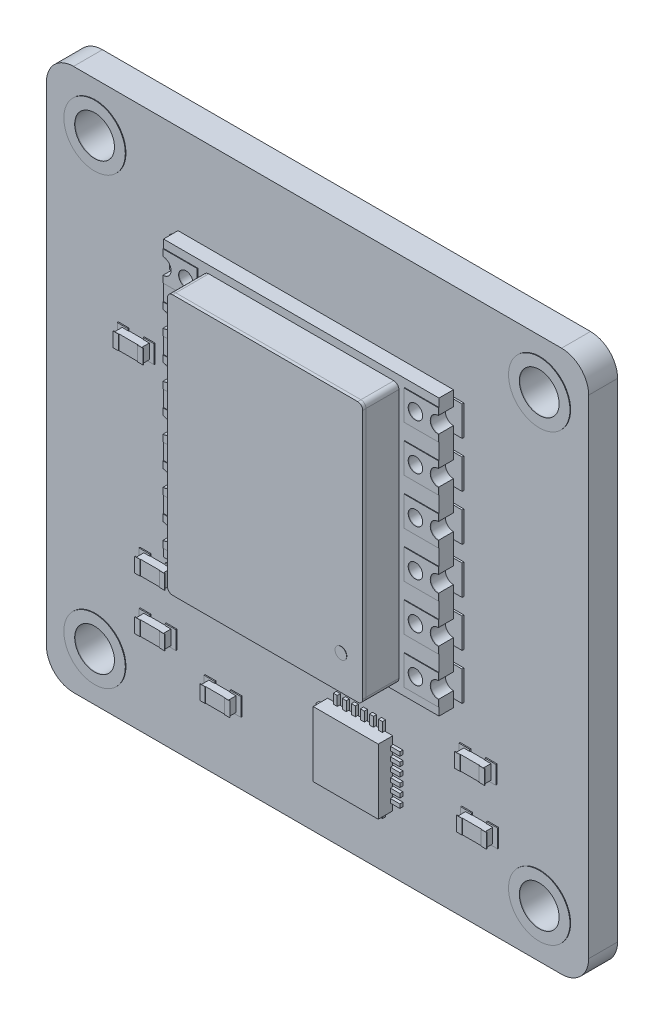
from build123d import *

# Parameters (mm, degrees)
PCB_30X30X1_6_D2_2_24_6_2_R              = 1.1
PCB_30X30X1_6_D2_2_24_6_DEPTH            = 1.6
EXTRUDE_START                            = 1.6
SKETCH_399_R                             = 1.7
SKETCH_399_R_2                           = 1.1
EXTRUDE_423_DEPTH                        = 0.035
EXTRUDE_423_2_DEPTH                      = 0.035
EXTRUDE_423_3_DEPTH                      = 0.035
EXTRUDE_423_4_DEPTH                      = 0.035
SKETCH_12_2_54_W                         = 2.5
SKETCH_12_2_54_H                         = 1.65
EXTRUDE_12_2_54_DEPTH                    = 0.1
EXTRUDE_12_2_54_2_DEPTH                  = 0.1
EXTRUDE_12_2_54_3_DEPTH                  = 0.1
EXTRUDE_12_2_54_4_DEPTH                  = 0.1
EXTRUDE_12_2_54_5_DEPTH                  = 0.1
EXTRUDE_12_2_54_6_DEPTH                  = 0.1
EXTRUDE_12_2_54_7_DEPTH                  = 0.1
EXTRUDE_12_2_54_8_DEPTH                  = 0.1
EXTRUDE_12_2_54_9_DEPTH                  = 0.1
EXTRUDE_12_2_54_10_DEPTH                 = 0.1
EXTRUDE_12_2_54_11_DEPTH                 = 0.1
EXTRUDE_12_2_54_12_DEPTH                 = 0.1
PCB_15_24X15_24X0_8_START                = 1.7
PCB_15_24X15_24X0_8_DEPTH                = 0.8
EXTRUDE_START_2                          = 2.5
EXTRUDE_12_DEPTH                         = 0.035
EXTRUDE_12_2_DEPTH                       = 0.035
EXTRUDE_12_3_DEPTH                       = 0.035
EXTRUDE_12_4_DEPTH                       = 0.035
EXTRUDE_12_5_DEPTH                       = 0.035
EXTRUDE_12_6_DEPTH                       = 0.035
EXTRUDE_12_7_DEPTH                       = 0.035
EXTRUDE_12_8_DEPTH                       = 0.035
EXTRUDE_12_9_DEPTH                       = 0.035
EXTRUDE_12_10_DEPTH                      = 0.035
EXTRUDE_12_11_DEPTH                      = 0.035
EXTRUDE_12_12_DEPTH                      = 0.035
EXTRUDE_0_18_DEPTH                       = 1.82
EXTRUDE_START_3                          = 4.32
EXTRUDE_0_18_2_8_DEPTH                   = 0.18
EXTRUDE_START_4                          = 4.5
SKETCH_1987_R                            = 0.32
EXTRUDE_1996_DEPTH                       = 0.012
EXTRUDE_START_5                          = 1.64
SKETCH_4X4_W                             = 3.6
SKETCH_4X4_H                             = 3.6
EXTRUDE_4X4_DEPTH                        = 0.8
SKETCH_24_W                              = 0.22
SKETCH_24_H                              = 0.55
EXTRUDE_24_DEPTH                         = 0.17
EXTRUDE_24_2_DEPTH                       = 0.17
SKETCH_24_W_2                            = 0.55
SKETCH_24_H_2                            = 0.22
EXTRUDE_24_3_DEPTH                       = 0.17
EXTRUDE_24_4_DEPTH                       = 0.17
EXTRUDE_24_5_DEPTH                       = 0.17
EXTRUDE_24_6_DEPTH                       = 0.17
EXTRUDE_24_7_DEPTH                       = 0.17
EXTRUDE_24_8_DEPTH                       = 0.17
EXTRUDE_24_9_DEPTH                       = 0.17
EXTRUDE_24_10_DEPTH                      = 0.17
EXTRUDE_24_11_DEPTH                      = 0.17
EXTRUDE_24_12_DEPTH                      = 0.17
EXTRUDE_24_13_DEPTH                      = 0.17
EXTRUDE_24_14_DEPTH                      = 0.17
EXTRUDE_24_15_DEPTH                      = 0.17
EXTRUDE_24_16_DEPTH                      = 0.17
EXTRUDE_24_17_DEPTH                      = 0.17
EXTRUDE_24_18_DEPTH                      = 0.17
EXTRUDE_24_19_DEPTH                      = 0.17
EXTRUDE_24_20_DEPTH                      = 0.17
EXTRUDE_24_21_DEPTH                      = 0.17
EXTRUDE_24_22_DEPTH                      = 0.17
EXTRUDE_24_23_DEPTH                      = 0.17
EXTRUDE_24_24_DEPTH                      = 0.17
SKETCH_3158_W                            = 0.6
SKETCH_3158_H                            = 1
EXTRUDE_3393_DEPTH                       = 0.06
EXTRUDE_3393_2_DEPTH                     = 0.06
EXTRUDE_3393_3_DEPTH                     = 0.06
EXTRUDE_3393_4_DEPTH                     = 0.06
EXTRUDE_3393_5_DEPTH                     = 0.06
EXTRUDE_3393_6_DEPTH                     = 0.06
EXTRUDE_3393_7_DEPTH                     = 0.06
EXTRUDE_3393_8_DEPTH                     = 0.06
EXTRUDE_3393_9_DEPTH                     = 0.06
EXTRUDE_3393_10_DEPTH                    = 0.06
EXTRUDE_3393_11_DEPTH                    = 0.06
EXTRUDE_3393_12_DEPTH                    = 0.06
SKETCH_1_W                               = 1.5
SKETCH_1_H                               = 0.8
EXTRUDE_1_DEPTH                          = 0.42
SKETCH_2_W                               = 1.5
SKETCH_2_H                               = 0.8
EXTRUDE_2_DEPTH                          = 0.42
SKETCH_3_W                               = 1.5
SKETCH_3_H                               = 0.8
EXTRUDE_3_DEPTH                          = 0.42
SKETCH_4_W                               = 1.5
SKETCH_4_H                               = 0.8
EXTRUDE_4_DEPTH                          = 0.42
SKETCH_5_W                               = 1.5
SKETCH_5_H                               = 0.8
EXTRUDE_5_DEPTH                          = 0.42
SKETCH_6_W                               = 1.5
SKETCH_6_H                               = 0.8
EXTRUDE_6_DEPTH                          = 0.42
EXTRUDE_START_6                          = 2.06
SKETCH_4124_W                            = 0.3
SKETCH_4124_H                            = 0.8
EXTRUDE_4359_DEPTH                       = 0.025
EXTRUDE_4359_2_DEPTH                     = 0.025
EXTRUDE_4359_3_DEPTH                     = 0.025
EXTRUDE_4359_4_DEPTH                     = 0.025
EXTRUDE_4359_5_DEPTH                     = 0.025
EXTRUDE_4359_6_DEPTH                     = 0.025
EXTRUDE_4359_7_DEPTH                     = 0.025
EXTRUDE_4359_8_DEPTH                     = 0.025
EXTRUDE_4359_9_DEPTH                     = 0.025
EXTRUDE_4359_10_DEPTH                    = 0.025
EXTRUDE_4359_11_DEPTH                    = 0.025
EXTRUDE_4359_12_DEPTH                    = 0.025
CUT_EXTRUDE_12_D0_8_12_7_2_54_DEPTH      = 22.687741791
CUT_EXTRUDE_12_D0_8_12_7_2_54_DEPTH_BACK = 22.687741791
F_12XD0_8_R                              = 0.4


with BuildPart() as part:
    # PCB_30x30x1.6__D2.2__24.6 2 → PCB_30x30x1.6__D2.2__24.6 (new body)
    with BuildSketch(Plane.XY):
        with BuildLine():
            Line((-13.5, -15), (13.5, -15))
            ThreePointArc((13.5, -15), (14.560660172, -14.560660172), (15, -13.5))
            Line((15, -13.5), (15, 13.5))
            ThreePointArc((15, 13.5), (14.560660172, 14.560660172), (13.5, 15))
            Line((13.5, 15), (-13.5, 15))
            ThreePointArc((-13.5, 15), (-14.560660172, 14.560660172), (-15, 13.5))
            Line((-15, 13.5), (-15, -13.5))
            ThreePointArc((-15, -13.5), (-14.560660172, -14.560660172), (-13.5, -15))
        make_face()
        with Locations((-12.3, -12.3)):
            Circle(PCB_30X30X1_6_D2_2_24_6_2_R, mode=Mode.SUBTRACT)
        with Locations((-12.3, 12.3)):
            Circle(PCB_30X30X1_6_D2_2_24_6_2_R, mode=Mode.SUBTRACT)
        with Locations((12.3, -12.3)):
            Circle(PCB_30X30X1_6_D2_2_24_6_2_R, mode=Mode.SUBTRACT)
        with Locations((12.3, 12.3)):
            Circle(PCB_30X30X1_6_D2_2_24_6_2_R, mode=Mode.SUBTRACT)
    extrude(amount=PCB_30X30X1_6_D2_2_24_6_DEPTH)


with BuildPart() as body_2:
    # Sketch 399 → Extrude 423 (new body)
    with BuildSketch(Plane.XY.offset(EXTRUDE_START)):
        with Locations((-12.3, -12.3)):
            Circle(SKETCH_399_R)
        with Locations((-12.3, -12.3)):
            Circle(SKETCH_399_R_2, mode=Mode.SUBTRACT)
    extrude(amount=EXTRUDE_423_DEPTH)


with BuildPart() as body_3:
    # Sketch 399 → Extrude 423 2 (new body)
    with BuildSketch(Plane.XY.offset(EXTRUDE_START)):
        with Locations((-12.3, 12.3)):
            Circle(SKETCH_399_R)
        with Locations((-12.3, 12.3)):
            Circle(SKETCH_399_R_2, mode=Mode.SUBTRACT)
    extrude(amount=EXTRUDE_423_2_DEPTH)


with BuildPart() as body_4:
    # Sketch 399 → Extrude 423 3 (new body)
    with BuildSketch(Plane.XY.offset(EXTRUDE_START)):
        with Locations((12.3, -12.3)):
            Circle(SKETCH_399_R)
        with Locations((12.3, -12.3)):
            Circle(SKETCH_399_R_2, mode=Mode.SUBTRACT)
    extrude(amount=EXTRUDE_423_3_DEPTH)


with BuildPart() as body_5:
    # Sketch 399 → Extrude 423 4 (new body)
    with BuildSketch(Plane.XY.offset(EXTRUDE_START)):
        with Locations((12.3, 12.3)):
            Circle(SKETCH_399_R)
        with Locations((12.3, 12.3)):
            Circle(SKETCH_399_R_2, mode=Mode.SUBTRACT)
    extrude(amount=EXTRUDE_423_4_DEPTH)


with BuildPart() as body_6:
    # 载板12处焊接焊盘_间距2.54_草图 → 载板12处焊接焊盘_间距2.54 (new body)
    with BuildSketch(Plane.XY.offset(EXTRUDE_START)):
        with Locations((-6.85, -3.85)):
            Rectangle(SKETCH_12_2_54_W, SKETCH_12_2_54_H)
    extrude(amount=EXTRUDE_12_2_54_DEPTH)


with BuildPart() as body_7:
    # 载板12处焊接焊盘_间距2.54_草图 → Extrude 12___2.54 2 (new body)
    with BuildSketch(Plane.XY.offset(EXTRUDE_START)):
        with Locations((-6.85, -1.31)):
            Rectangle(SKETCH_12_2_54_W, SKETCH_12_2_54_H)
    extrude(amount=EXTRUDE_12_2_54_2_DEPTH)


with BuildPart() as body_8:
    # 载板12处焊接焊盘_间距2.54_草图 → Extrude 12___2.54 3 (new body)
    with BuildSketch(Plane.XY.offset(EXTRUDE_START)):
        with Locations((-6.85, 1.23)):
            Rectangle(SKETCH_12_2_54_W, SKETCH_12_2_54_H)
    extrude(amount=EXTRUDE_12_2_54_3_DEPTH)


with BuildPart() as body_9:
    # 载板12处焊接焊盘_间距2.54_草图 → Extrude 12___2.54 4 (new body)
    with BuildSketch(Plane.XY.offset(EXTRUDE_START)):
        with Locations((-6.85, 3.77)):
            Rectangle(SKETCH_12_2_54_W, SKETCH_12_2_54_H)
    extrude(amount=EXTRUDE_12_2_54_4_DEPTH)


with BuildPart() as body_10:
    # 载板12处焊接焊盘_间距2.54_草图 → Extrude 12___2.54 5 (new body)
    with BuildSketch(Plane.XY.offset(EXTRUDE_START)):
        with Locations((-6.85, 6.31)):
            Rectangle(SKETCH_12_2_54_W, SKETCH_12_2_54_H)
    extrude(amount=EXTRUDE_12_2_54_5_DEPTH)


with BuildPart() as body_11:
    # 载板12处焊接焊盘_间距2.54_草图 → Extrude 12___2.54 6 (new body)
    with BuildSketch(Plane.XY.offset(EXTRUDE_START)):
        with Locations((-6.85, 8.85)):
            Rectangle(SKETCH_12_2_54_W, SKETCH_12_2_54_H)
    extrude(amount=EXTRUDE_12_2_54_6_DEPTH)


with BuildPart() as body_12:
    # 载板12处焊接焊盘_间距2.54_草图 → Extrude 12___2.54 7 (new body)
    with BuildSketch(Plane.XY.offset(EXTRUDE_START)):
        with Locations((6.85, -3.85)):
            Rectangle(SKETCH_12_2_54_W, SKETCH_12_2_54_H)
    extrude(amount=EXTRUDE_12_2_54_7_DEPTH)


with BuildPart() as body_13:
    # 载板12处焊接焊盘_间距2.54_草图 → Extrude 12___2.54 8 (new body)
    with BuildSketch(Plane.XY.offset(EXTRUDE_START)):
        with Locations((6.85, -1.31)):
            Rectangle(SKETCH_12_2_54_W, SKETCH_12_2_54_H)
    extrude(amount=EXTRUDE_12_2_54_8_DEPTH)


with BuildPart() as body_14:
    # 载板12处焊接焊盘_间距2.54_草图 → Extrude 12___2.54 9 (new body)
    with BuildSketch(Plane.XY.offset(EXTRUDE_START)):
        with Locations((6.85, 1.23)):
            Rectangle(SKETCH_12_2_54_W, SKETCH_12_2_54_H)
    extrude(amount=EXTRUDE_12_2_54_9_DEPTH)


with BuildPart() as body_15:
    # 载板12处焊接焊盘_间距2.54_草图 → Extrude 12___2.54 10 (new body)
    with BuildSketch(Plane.XY.offset(EXTRUDE_START)):
        with Locations((6.85, 3.77)):
            Rectangle(SKETCH_12_2_54_W, SKETCH_12_2_54_H)
    extrude(amount=EXTRUDE_12_2_54_10_DEPTH)


with BuildPart() as body_16:
    # 载板12处焊接焊盘_间距2.54_草图 → Extrude 12___2.54 11 (new body)
    with BuildSketch(Plane.XY.offset(EXTRUDE_START)):
        with Locations((6.85, 6.31)):
            Rectangle(SKETCH_12_2_54_W, SKETCH_12_2_54_H)
    extrude(amount=EXTRUDE_12_2_54_11_DEPTH)


with BuildPart() as body_17:
    # 载板12处焊接焊盘_间距2.54_草图 → Extrude 12___2.54 12 (new body)
    with BuildSketch(Plane.XY.offset(EXTRUDE_START)):
        with Locations((6.85, 8.85)):
            Rectangle(SKETCH_12_2_54_W, SKETCH_12_2_54_H)
    extrude(amount=EXTRUDE_12_2_54_12_DEPTH)


with BuildPart() as body_18:
    # PCB_15.24x15.24x0.8 2 → PCB_15.24x15.24x0.8 (new body)
    with BuildSketch(Plane.XY.offset(PCB_15_24X15_24X0_8_START)):
        with BuildLine():
            Line((-7.62, -5.12), (7.62, -5.12))
            Line((7.62, -5.12), (7.62, -4.3))
            ThreePointArc((7.62, -4.3), (7.17, -3.85), (7.62, -3.4))
            Line((7.62, -3.4), (7.62, -1.76))
            ThreePointArc((7.62, -1.76), (7.17, -1.31), (7.62, -0.86))
            Line((7.62, -0.86), (7.62, 0.78))
            ThreePointArc((7.62, 0.78), (7.17, 1.23), (7.62, 1.68))
            Line((7.62, 1.68), (7.62, 3.32))
            ThreePointArc((7.62, 3.32), (7.17, 3.77), (7.62, 4.22))
            Line((7.62, 4.22), (7.62, 5.86))
            ThreePointArc((7.62, 5.86), (7.17, 6.31), (7.62, 6.76))
            Line((7.62, 6.76), (7.62, 8.4))
            ThreePointArc((7.62, 8.4), (7.17, 8.85), (7.62, 9.3))
            Line((7.62, 9.3), (7.62, 10.12))
            Line((7.62, 10.12), (-7.62, 10.12))
            Line((-7.62, 10.12), (-7.62, 9.3))
            ThreePointArc((-7.62, 9.3), (-7.17, 8.85), (-7.62, 8.4))
            Line((-7.62, 8.4), (-7.62, 6.76))
            ThreePointArc((-7.62, 6.76), (-7.17, 6.31), (-7.62, 5.86))
            Line((-7.62, 5.86), (-7.62, 4.22))
            ThreePointArc((-7.62, 4.22), (-7.17, 3.77), (-7.62, 3.32))
            Line((-7.62, 3.32), (-7.62, 1.68))
            ThreePointArc((-7.62, 1.68), (-7.17, 1.23), (-7.62, 0.78))
            Line((-7.62, 0.78), (-7.62, -0.86))
            ThreePointArc((-7.62, -0.86), (-7.17, -1.31), (-7.62, -1.76))
            Line((-7.62, -1.76), (-7.62, -3.4))
            ThreePointArc((-7.62, -3.4), (-7.17, -3.85), (-7.62, -4.3))
            Line((-7.62, -4.3), (-7.62, -5.12))
        make_face()
    extrude(amount=PCB_15_24X15_24X0_8_DEPTH)


with BuildPart() as body_19:
    # 模块12处半孔镀锡焊盘_草图 → 模块12处半孔镀锡焊盘 (new body)
    with BuildSketch(Plane.XY.offset(EXTRUDE_START_2)):
        with BuildLine():
            Line((-5.72, -4.67), (-5.72, -3.03))
            Line((-5.72, -3.03), (-7.62, -3.03))
            Line((-7.62, -3.03), (-7.62, -3.4))
            ThreePointArc((-7.62, -3.4), (-7.17, -3.85), (-7.62, -4.3))
            Line((-7.62, -4.3), (-7.62, -4.67))
            Line((-7.62, -4.67), (-5.72, -4.67))
        make_face()
    extrude(amount=EXTRUDE_12_DEPTH)


with BuildPart() as body_20:
    # 模块12处半孔镀锡焊盘_草图 → Extrude 12 2 (new body)
    with BuildSketch(Plane.XY.offset(EXTRUDE_START_2)):
        with BuildLine():
            Line((-5.72, -2.13), (-5.72, -0.49))
            Line((-5.72, -0.49), (-7.62, -0.49))
            Line((-7.62, -0.49), (-7.62, -0.86))
            ThreePointArc((-7.62, -0.86), (-7.17, -1.31), (-7.62, -1.76))
            Line((-7.62, -1.76), (-7.62, -2.13))
            Line((-7.62, -2.13), (-5.72, -2.13))
        make_face()
    extrude(amount=EXTRUDE_12_2_DEPTH)


with BuildPart() as body_21:
    # 模块12处半孔镀锡焊盘_草图 → Extrude 12 3 (new body)
    with BuildSketch(Plane.XY.offset(EXTRUDE_START_2)):
        with BuildLine():
            Line((-5.72, 0.41), (-5.72, 2.05))
            Line((-5.72, 2.05), (-7.62, 2.05))
            Line((-7.62, 2.05), (-7.62, 1.68))
            ThreePointArc((-7.62, 1.68), (-7.17, 1.23), (-7.62, 0.78))
            Line((-7.62, 0.78), (-7.62, 0.41))
            Line((-7.62, 0.41), (-5.72, 0.41))
        make_face()
    extrude(amount=EXTRUDE_12_3_DEPTH)


with BuildPart() as body_22:
    # 模块12处半孔镀锡焊盘_草图 → Extrude 12 4 (new body)
    with BuildSketch(Plane.XY.offset(EXTRUDE_START_2)):
        with BuildLine():
            Line((-5.72, 2.95), (-5.72, 4.59))
            Line((-5.72, 4.59), (-7.62, 4.59))
            Line((-7.62, 4.59), (-7.62, 4.22))
            ThreePointArc((-7.62, 4.22), (-7.17, 3.77), (-7.62, 3.32))
            Line((-7.62, 3.32), (-7.62, 2.95))
            Line((-7.62, 2.95), (-5.72, 2.95))
        make_face()
    extrude(amount=EXTRUDE_12_4_DEPTH)


with BuildPart() as body_23:
    # 模块12处半孔镀锡焊盘_草图 → Extrude 12 5 (new body)
    with BuildSketch(Plane.XY.offset(EXTRUDE_START_2)):
        with BuildLine():
            Line((-5.72, 5.49), (-5.72, 7.13))
            Line((-5.72, 7.13), (-7.62, 7.13))
            Line((-7.62, 7.13), (-7.62, 6.76))
            ThreePointArc((-7.62, 6.76), (-7.17, 6.31), (-7.62, 5.86))
            Line((-7.62, 5.86), (-7.62, 5.49))
            Line((-7.62, 5.49), (-5.72, 5.49))
        make_face()
    extrude(amount=EXTRUDE_12_5_DEPTH)


with BuildPart() as body_24:
    # 模块12处半孔镀锡焊盘_草图 → Extrude 12 6 (new body)
    with BuildSketch(Plane.XY.offset(EXTRUDE_START_2)):
        with BuildLine():
            Line((-5.72, 8.03), (-5.72, 9.67))
            Line((-5.72, 9.67), (-7.62, 9.67))
            Line((-7.62, 9.67), (-7.62, 9.3))
            ThreePointArc((-7.62, 9.3), (-7.17, 8.85), (-7.62, 8.4))
            Line((-7.62, 8.4), (-7.62, 8.03))
            Line((-7.62, 8.03), (-5.72, 8.03))
        make_face()
    extrude(amount=EXTRUDE_12_6_DEPTH)


with BuildPart() as body_25:
    # 模块12处半孔镀锡焊盘_草图 → Extrude 12 7 (new body)
    with BuildSketch(Plane.XY.offset(EXTRUDE_START_2)):
        with BuildLine():
            Line((5.72, -4.67), (7.62, -4.67))
            Line((7.62, -4.67), (7.62, -4.3))
            ThreePointArc((7.62, -4.3), (7.17, -3.85), (7.62, -3.4))
            Line((7.62, -3.4), (7.62, -3.03))
            Line((7.62, -3.03), (5.72, -3.03))
            Line((5.72, -3.03), (5.72, -4.67))
        make_face()
    extrude(amount=EXTRUDE_12_7_DEPTH)


with BuildPart() as body_26:
    # 模块12处半孔镀锡焊盘_草图 → Extrude 12 8 (new body)
    with BuildSketch(Plane.XY.offset(EXTRUDE_START_2)):
        with BuildLine():
            Line((5.72, -2.13), (7.62, -2.13))
            Line((7.62, -2.13), (7.62, -1.76))
            ThreePointArc((7.62, -1.76), (7.17, -1.31), (7.62, -0.86))
            Line((7.62, -0.86), (7.62, -0.49))
            Line((7.62, -0.49), (5.72, -0.49))
            Line((5.72, -0.49), (5.72, -2.13))
        make_face()
    extrude(amount=EXTRUDE_12_8_DEPTH)


with BuildPart() as body_27:
    # 模块12处半孔镀锡焊盘_草图 → Extrude 12 9 (new body)
    with BuildSketch(Plane.XY.offset(EXTRUDE_START_2)):
        with BuildLine():
            Line((5.72, 0.41), (7.62, 0.41))
            Line((7.62, 0.41), (7.62, 0.78))
            ThreePointArc((7.62, 0.78), (7.17, 1.23), (7.62, 1.68))
            Line((7.62, 1.68), (7.62, 2.05))
            Line((7.62, 2.05), (5.72, 2.05))
            Line((5.72, 2.05), (5.72, 0.41))
        make_face()
    extrude(amount=EXTRUDE_12_9_DEPTH)


with BuildPart() as body_28:
    # 模块12处半孔镀锡焊盘_草图 → Extrude 12 10 (new body)
    with BuildSketch(Plane.XY.offset(EXTRUDE_START_2)):
        with BuildLine():
            Line((5.72, 2.95), (7.62, 2.95))
            Line((7.62, 2.95), (7.62, 3.32))
            ThreePointArc((7.62, 3.32), (7.17, 3.77), (7.62, 4.22))
            Line((7.62, 4.22), (7.62, 4.59))
            Line((7.62, 4.59), (5.72, 4.59))
            Line((5.72, 4.59), (5.72, 2.95))
        make_face()
    extrude(amount=EXTRUDE_12_10_DEPTH)


with BuildPart() as body_29:
    # 模块12处半孔镀锡焊盘_草图 → Extrude 12 11 (new body)
    with BuildSketch(Plane.XY.offset(EXTRUDE_START_2)):
        with BuildLine():
            Line((5.72, 5.49), (7.62, 5.49))
            Line((7.62, 5.49), (7.62, 5.86))
            ThreePointArc((7.62, 5.86), (7.17, 6.31), (7.62, 6.76))
            Line((7.62, 6.76), (7.62, 7.13))
            Line((7.62, 7.13), (5.72, 7.13))
            Line((5.72, 7.13), (5.72, 5.49))
        make_face()
    extrude(amount=EXTRUDE_12_11_DEPTH)


with BuildPart() as body_30:
    # 模块12处半孔镀锡焊盘_草图 → Extrude 12 12 (new body)
    with BuildSketch(Plane.XY.offset(EXTRUDE_START_2)):
        with BuildLine():
            Line((5.72, 8.03), (7.62, 8.03))
            Line((7.62, 8.03), (7.62, 8.4))
            ThreePointArc((7.62, 8.4), (7.17, 8.85), (7.62, 9.3))
            Line((7.62, 9.3), (7.62, 9.67))
            Line((7.62, 9.67), (5.72, 9.67))
            Line((5.72, 9.67), (5.72, 8.03))
        make_face()
    extrude(amount=EXTRUDE_12_12_DEPTH)


with BuildPart() as body_31:
    # 屏蔽罩侧壁_厚0.18_草图 → 屏蔽罩侧壁_厚0.18 (new body)
    with BuildSketch(Plane.XY.offset(EXTRUDE_START_2)):
        with BuildLine():
            Line((-5.12, -4.7), (5.12, -4.7))
            ThreePointArc((5.12, -4.7), (5.317989899, -4.617989899), (5.4, -4.42))
            Line((5.4, -4.42), (5.4, 9.42))
            ThreePointArc((5.4, 9.42), (5.317989899, 9.617989899), (5.12, 9.7))
            Line((5.12, 9.7), (-5.12, 9.7))
            ThreePointArc((-5.12, 9.7), (-5.317989899, 9.617989899), (-5.4, 9.42))
            Line((-5.4, 9.42), (-5.4, -4.42))
            ThreePointArc((-5.4, -4.42), (-5.317989899, -4.617989899), (-5.12, -4.7))
        make_face()
        with BuildLine():
            Line((-5.12, -4.52), (5.12, -4.52))
            ThreePointArc((5.12, -4.52), (5.190710678, -4.490710678), (5.22, -4.42))
            Line((5.22, -4.42), (5.22, 9.42))
            ThreePointArc((5.22, 9.42), (5.190710678, 9.490710678), (5.12, 9.52))
            Line((5.12, 9.52), (-5.12, 9.52))
            ThreePointArc((-5.12, 9.52), (-5.190710678, 9.490710678), (-5.22, 9.42))
            Line((-5.22, 9.42), (-5.22, -4.42))
            ThreePointArc((-5.22, -4.42), (-5.190710678, -4.490710678), (-5.12, -4.52))
        make_face(mode=Mode.SUBTRACT)
    extrude(amount=EXTRUDE_0_18_DEPTH)


with BuildPart() as body_32:
    # 屏蔽罩顶盖_厚0.18_模块总高2.8_草图 → 屏蔽罩顶盖_厚0.18_模块总高2.8 (new body)
    with BuildSketch(Plane.XY.offset(EXTRUDE_START_3)):
        with BuildLine():
            Line((-5.12, -4.7), (5.12, -4.7))
            ThreePointArc((5.12, -4.7), (5.317989899, -4.617989899), (5.4, -4.42))
            Line((5.4, -4.42), (5.4, 9.42))
            ThreePointArc((5.4, 9.42), (5.317989899, 9.617989899), (5.12, 9.7))
            Line((5.12, 9.7), (-5.12, 9.7))
            ThreePointArc((-5.12, 9.7), (-5.317989899, 9.617989899), (-5.4, 9.42))
            Line((-5.4, 9.42), (-5.4, -4.42))
            ThreePointArc((-5.4, -4.42), (-5.317989899, -4.617989899), (-5.12, -4.7))
        make_face()
    extrude(amount=EXTRUDE_0_18_2_8_DEPTH)


with BuildPart() as body_33:
    # Sketch 1987 → Extrude 1996 (new body)
    with BuildSketch(Plane.XY.offset(EXTRUDE_START_4)):
        with Locations((4.2, -2.8)):
            Circle(SKETCH_1987_R)
    extrude(amount=EXTRUDE_1996_DEPTH)


with BuildPart() as body_34:
    # 载板控制芯片_4x4_草图 → 载板控制芯片_4x4 (new body)
    with BuildSketch(Plane.XY.offset(EXTRUDE_START_5)):
        with Locations((2.4, -10)):
            Rectangle(SKETCH_4X4_W, SKETCH_4X4_H)
    extrude(amount=EXTRUDE_4X4_DEPTH)


with BuildPart() as body_35:
    # 载板控制芯片24引脚_草图 → 载板控制芯片24引脚 (new body)
    with BuildSketch(Plane.XY.offset(EXTRUDE_START)):
        with Locations((1.15, -12.05)):
            Rectangle(SKETCH_24_W, SKETCH_24_H)
    extrude(amount=EXTRUDE_24_DEPTH)


with BuildPart() as body_36:
    # 载板控制芯片24引脚_草图 → Extrude 24 2 (new body)
    with BuildSketch(Plane.XY.offset(EXTRUDE_START)):
        with Locations((1.15, -7.95)):
            Rectangle(SKETCH_24_W, SKETCH_24_H)
    extrude(amount=EXTRUDE_24_2_DEPTH)


with BuildPart() as body_37:
    # 载板控制芯片24引脚_草图 → Extrude 24 3 (new body)
    with BuildSketch(Plane.XY.offset(EXTRUDE_START)):
        with Locations((0.35, -11.25)):
            Rectangle(SKETCH_24_W_2, SKETCH_24_H_2)
    extrude(amount=EXTRUDE_24_3_DEPTH)


with BuildPart() as body_38:
    # 载板控制芯片24引脚_草图 → Extrude 24 4 (new body)
    with BuildSketch(Plane.XY.offset(EXTRUDE_START)):
        with Locations((4.45, -11.25)):
            Rectangle(SKETCH_24_W_2, SKETCH_24_H_2)
    extrude(amount=EXTRUDE_24_4_DEPTH)


with BuildPart() as body_39:
    # 载板控制芯片24引脚_草图 → Extrude 24 5 (new body)
    with BuildSketch(Plane.XY.offset(EXTRUDE_START)):
        with Locations((1.65, -12.05)):
            Rectangle(SKETCH_24_W, SKETCH_24_H)
    extrude(amount=EXTRUDE_24_5_DEPTH)


with BuildPart() as body_40:
    # 载板控制芯片24引脚_草图 → Extrude 24 6 (new body)
    with BuildSketch(Plane.XY.offset(EXTRUDE_START)):
        with Locations((1.65, -7.95)):
            Rectangle(SKETCH_24_W, SKETCH_24_H)
    extrude(amount=EXTRUDE_24_6_DEPTH)


with BuildPart() as body_41:
    # 载板控制芯片24引脚_草图 → Extrude 24 7 (new body)
    with BuildSketch(Plane.XY.offset(EXTRUDE_START)):
        with Locations((0.35, -10.75)):
            Rectangle(SKETCH_24_W_2, SKETCH_24_H_2)
    extrude(amount=EXTRUDE_24_7_DEPTH)


with BuildPart() as body_42:
    # 载板控制芯片24引脚_草图 → Extrude 24 8 (new body)
    with BuildSketch(Plane.XY.offset(EXTRUDE_START)):
        with Locations((4.45, -10.75)):
            Rectangle(SKETCH_24_W_2, SKETCH_24_H_2)
    extrude(amount=EXTRUDE_24_8_DEPTH)


with BuildPart() as body_43:
    # 载板控制芯片24引脚_草图 → Extrude 24 9 (new body)
    with BuildSketch(Plane.XY.offset(EXTRUDE_START)):
        with Locations((2.15, -12.05)):
            Rectangle(SKETCH_24_W, SKETCH_24_H)
    extrude(amount=EXTRUDE_24_9_DEPTH)


with BuildPart() as body_44:
    # 载板控制芯片24引脚_草图 → Extrude 24 10 (new body)
    with BuildSketch(Plane.XY.offset(EXTRUDE_START)):
        with Locations((2.15, -7.95)):
            Rectangle(SKETCH_24_W, SKETCH_24_H)
    extrude(amount=EXTRUDE_24_10_DEPTH)


with BuildPart() as body_45:
    # 载板控制芯片24引脚_草图 → Extrude 24 11 (new body)
    with BuildSketch(Plane.XY.offset(EXTRUDE_START)):
        with Locations((0.35, -10.25)):
            Rectangle(SKETCH_24_W_2, SKETCH_24_H_2)
    extrude(amount=EXTRUDE_24_11_DEPTH)


with BuildPart() as body_46:
    # 载板控制芯片24引脚_草图 → Extrude 24 12 (new body)
    with BuildSketch(Plane.XY.offset(EXTRUDE_START)):
        with Locations((4.45, -10.25)):
            Rectangle(SKETCH_24_W_2, SKETCH_24_H_2)
    extrude(amount=EXTRUDE_24_12_DEPTH)


with BuildPart() as body_47:
    # 载板控制芯片24引脚_草图 → Extrude 24 13 (new body)
    with BuildSketch(Plane.XY.offset(EXTRUDE_START)):
        with Locations((2.65, -12.05)):
            Rectangle(SKETCH_24_W, SKETCH_24_H)
    extrude(amount=EXTRUDE_24_13_DEPTH)


with BuildPart() as body_48:
    # 载板控制芯片24引脚_草图 → Extrude 24 14 (new body)
    with BuildSketch(Plane.XY.offset(EXTRUDE_START)):
        with Locations((2.65, -7.95)):
            Rectangle(SKETCH_24_W, SKETCH_24_H)
    extrude(amount=EXTRUDE_24_14_DEPTH)


with BuildPart() as body_49:
    # 载板控制芯片24引脚_草图 → Extrude 24 15 (new body)
    with BuildSketch(Plane.XY.offset(EXTRUDE_START)):
        with Locations((0.35, -9.75)):
            Rectangle(SKETCH_24_W_2, SKETCH_24_H_2)
    extrude(amount=EXTRUDE_24_15_DEPTH)


with BuildPart() as body_50:
    # 载板控制芯片24引脚_草图 → Extrude 24 16 (new body)
    with BuildSketch(Plane.XY.offset(EXTRUDE_START)):
        with Locations((4.45, -9.75)):
            Rectangle(SKETCH_24_W_2, SKETCH_24_H_2)
    extrude(amount=EXTRUDE_24_16_DEPTH)


with BuildPart() as body_51:
    # 载板控制芯片24引脚_草图 → Extrude 24 17 (new body)
    with BuildSketch(Plane.XY.offset(EXTRUDE_START)):
        with Locations((3.15, -12.05)):
            Rectangle(SKETCH_24_W, SKETCH_24_H)
    extrude(amount=EXTRUDE_24_17_DEPTH)


with BuildPart() as body_52:
    # 载板控制芯片24引脚_草图 → Extrude 24 18 (new body)
    with BuildSketch(Plane.XY.offset(EXTRUDE_START)):
        with Locations((3.15, -7.95)):
            Rectangle(SKETCH_24_W, SKETCH_24_H)
    extrude(amount=EXTRUDE_24_18_DEPTH)


with BuildPart() as body_53:
    # 载板控制芯片24引脚_草图 → Extrude 24 19 (new body)
    with BuildSketch(Plane.XY.offset(EXTRUDE_START)):
        with Locations((0.35, -9.25)):
            Rectangle(SKETCH_24_W_2, SKETCH_24_H_2)
    extrude(amount=EXTRUDE_24_19_DEPTH)


with BuildPart() as body_54:
    # 载板控制芯片24引脚_草图 → Extrude 24 20 (new body)
    with BuildSketch(Plane.XY.offset(EXTRUDE_START)):
        with Locations((4.45, -9.25)):
            Rectangle(SKETCH_24_W_2, SKETCH_24_H_2)
    extrude(amount=EXTRUDE_24_20_DEPTH)


with BuildPart() as body_55:
    # 载板控制芯片24引脚_草图 → Extrude 24 21 (new body)
    with BuildSketch(Plane.XY.offset(EXTRUDE_START)):
        with Locations((3.65, -12.05)):
            Rectangle(SKETCH_24_W, SKETCH_24_H)
    extrude(amount=EXTRUDE_24_21_DEPTH)


with BuildPart() as body_56:
    # 载板控制芯片24引脚_草图 → Extrude 24 22 (new body)
    with BuildSketch(Plane.XY.offset(EXTRUDE_START)):
        with Locations((3.65, -7.95)):
            Rectangle(SKETCH_24_W, SKETCH_24_H)
    extrude(amount=EXTRUDE_24_22_DEPTH)


with BuildPart() as body_57:
    # 载板控制芯片24引脚_草图 → Extrude 24 23 (new body)
    with BuildSketch(Plane.XY.offset(EXTRUDE_START)):
        with Locations((0.35, -8.75)):
            Rectangle(SKETCH_24_W_2, SKETCH_24_H_2)
    extrude(amount=EXTRUDE_24_23_DEPTH)


with BuildPart() as body_58:
    # 载板控制芯片24引脚_草图 → Extrude 24 24 (new body)
    with BuildSketch(Plane.XY.offset(EXTRUDE_START)):
        with Locations((4.45, -8.75)):
            Rectangle(SKETCH_24_W_2, SKETCH_24_H_2)
    extrude(amount=EXTRUDE_24_24_DEPTH)


with BuildPart() as body_59:
    # Sketch 3158 → Extrude 3393 (new body)
    with BuildSketch(Plane.XY.offset(EXTRUDE_START)):
        with Locations((-9.52, -9.6)):
            Rectangle(SKETCH_3158_W, SKETCH_3158_H)
    extrude(amount=EXTRUDE_3393_DEPTH)


with BuildPart() as body_60:
    # Sketch 3158 → Extrude 3393 2 (new body)
    with BuildSketch(Plane.XY.offset(EXTRUDE_START)):
        with Locations((-8.08, -9.6)):
            Rectangle(SKETCH_3158_W, SKETCH_3158_H)
    extrude(amount=EXTRUDE_3393_2_DEPTH)


with BuildPart() as body_61:
    # Sketch 3158 → Extrude 3393 3 (new body)
    with BuildSketch(Plane.XY.offset(EXTRUDE_START)):
        with Locations((-9.52, -6.7)):
            Rectangle(SKETCH_3158_W, SKETCH_3158_H)
    extrude(amount=EXTRUDE_3393_3_DEPTH)


with BuildPart() as body_62:
    # Sketch 3158 → Extrude 3393 4 (new body)
    with BuildSketch(Plane.XY.offset(EXTRUDE_START)):
        with Locations((-8.08, -6.7)):
            Rectangle(SKETCH_3158_W, SKETCH_3158_H)
    extrude(amount=EXTRUDE_3393_4_DEPTH)


with BuildPart() as body_63:
    # Sketch 3158 → Extrude 3393 5 (new body)
    with BuildSketch(Plane.XY.offset(EXTRUDE_START)):
        with Locations((-5.92, -11)):
            Rectangle(SKETCH_3158_W, SKETCH_3158_H)
    extrude(amount=EXTRUDE_3393_5_DEPTH)


with BuildPart() as body_64:
    # Sketch 3158 → Extrude 3393 6 (new body)
    with BuildSketch(Plane.XY.offset(EXTRUDE_START)):
        with Locations((-4.48, -11)):
            Rectangle(SKETCH_3158_W, SKETCH_3158_H)
    extrude(amount=EXTRUDE_3393_6_DEPTH)


with BuildPart() as body_65:
    # Sketch 3158 → Extrude 3393 7 (new body)
    with BuildSketch(Plane.XY.offset(EXTRUDE_START)):
        with Locations((8.18, -7.2)):
            Rectangle(SKETCH_3158_W, SKETCH_3158_H)
    extrude(amount=EXTRUDE_3393_7_DEPTH)


with BuildPart() as body_66:
    # Sketch 3158 → Extrude 3393 8 (new body)
    with BuildSketch(Plane.XY.offset(EXTRUDE_START)):
        with Locations((9.62, -7.2)):
            Rectangle(SKETCH_3158_W, SKETCH_3158_H)
    extrude(amount=EXTRUDE_3393_8_DEPTH)


with BuildPart() as body_67:
    # Sketch 3158 → Extrude 3393 9 (new body)
    with BuildSketch(Plane.XY.offset(EXTRUDE_START)):
        with Locations((8.28, -10.2)):
            Rectangle(SKETCH_3158_W, SKETCH_3158_H)
    extrude(amount=EXTRUDE_3393_9_DEPTH)


with BuildPart() as body_68:
    # Sketch 3158 → Extrude 3393 10 (new body)
    with BuildSketch(Plane.XY.offset(EXTRUDE_START)):
        with Locations((9.72, -10.2)):
            Rectangle(SKETCH_3158_W, SKETCH_3158_H)
    extrude(amount=EXTRUDE_3393_10_DEPTH)


with BuildPart() as body_69:
    # Sketch 3158 → Extrude 3393 11 (new body)
    with BuildSketch(Plane.XY.offset(EXTRUDE_START)):
        with Locations((-10.72, 3.5)):
            Rectangle(SKETCH_3158_W, SKETCH_3158_H)
    extrude(amount=EXTRUDE_3393_11_DEPTH)


with BuildPart() as body_70:
    # Sketch 3158 → Extrude 3393 12 (new body)
    with BuildSketch(Plane.XY.offset(EXTRUDE_START)):
        with Locations((-9.28, 3.5)):
            Rectangle(SKETCH_3158_W, SKETCH_3158_H)
    extrude(amount=EXTRUDE_3393_12_DEPTH)


with BuildPart() as body_71:
    # 贴片元件_1_草图 → 贴片元件_1 (new body)
    with BuildSketch(Plane.XY.offset(EXTRUDE_START_5)):
        with Locations((-8.8, -9.6)):
            Rectangle(SKETCH_1_W, SKETCH_1_H)
    extrude(amount=EXTRUDE_1_DEPTH)


with BuildPart() as body_72:
    # 贴片元件_2_草图 → 贴片元件_2 (new body)
    with BuildSketch(Plane.XY.offset(EXTRUDE_START_5)):
        with Locations((-8.8, -6.7)):
            Rectangle(SKETCH_2_W, SKETCH_2_H)
    extrude(amount=EXTRUDE_2_DEPTH)


with BuildPart() as body_73:
    # 贴片元件_3_草图 → 贴片元件_3 (new body)
    with BuildSketch(Plane.XY.offset(EXTRUDE_START_5)):
        with Locations((-5.2, -11)):
            Rectangle(SKETCH_3_W, SKETCH_3_H)
    extrude(amount=EXTRUDE_3_DEPTH)


with BuildPart() as body_74:
    # 贴片元件_4_草图 → 贴片元件_4 (new body)
    with BuildSketch(Plane.XY.offset(EXTRUDE_START_5)):
        with Locations((8.9, -7.2)):
            Rectangle(SKETCH_4_W, SKETCH_4_H)
    extrude(amount=EXTRUDE_4_DEPTH)


with BuildPart() as body_75:
    # 贴片元件_5_草图 → 贴片元件_5 (new body)
    with BuildSketch(Plane.XY.offset(EXTRUDE_START_5)):
        with Locations((9, -10.2)):
            Rectangle(SKETCH_5_W, SKETCH_5_H)
    extrude(amount=EXTRUDE_5_DEPTH)


with BuildPart() as body_76:
    # 贴片元件_6_草图 → 贴片元件_6 (new body)
    with BuildSketch(Plane.XY.offset(EXTRUDE_START_5)):
        with Locations((-10, 3.5)):
            Rectangle(SKETCH_6_W, SKETCH_6_H)
    extrude(amount=EXTRUDE_6_DEPTH)


with BuildPart() as body_77:
    # Sketch 4124 → Extrude 4359 (new body)
    with BuildSketch(Plane.XY.offset(EXTRUDE_START_6)):
        with Locations((-9.48, -9.6)):
            Rectangle(SKETCH_4124_W, SKETCH_4124_H)
    extrude(amount=EXTRUDE_4359_DEPTH)


with BuildPart() as body_78:
    # Sketch 4124 → Extrude 4359 2 (new body)
    with BuildSketch(Plane.XY.offset(EXTRUDE_START_6)):
        with Locations((-8.12, -9.6)):
            Rectangle(SKETCH_4124_W, SKETCH_4124_H)
    extrude(amount=EXTRUDE_4359_2_DEPTH)


with BuildPart() as body_79:
    # Sketch 4124 → Extrude 4359 3 (new body)
    with BuildSketch(Plane.XY.offset(EXTRUDE_START_6)):
        with Locations((-9.48, -6.7)):
            Rectangle(SKETCH_4124_W, SKETCH_4124_H)
    extrude(amount=EXTRUDE_4359_3_DEPTH)


with BuildPart() as body_80:
    # Sketch 4124 → Extrude 4359 4 (new body)
    with BuildSketch(Plane.XY.offset(EXTRUDE_START_6)):
        with Locations((-8.12, -6.7)):
            Rectangle(SKETCH_4124_W, SKETCH_4124_H)
    extrude(amount=EXTRUDE_4359_4_DEPTH)


with BuildPart() as body_81:
    # Sketch 4124 → Extrude 4359 5 (new body)
    with BuildSketch(Plane.XY.offset(EXTRUDE_START_6)):
        with Locations((-5.88, -11)):
            Rectangle(SKETCH_4124_W, SKETCH_4124_H)
    extrude(amount=EXTRUDE_4359_5_DEPTH)


with BuildPart() as body_82:
    # Sketch 4124 → Extrude 4359 6 (new body)
    with BuildSketch(Plane.XY.offset(EXTRUDE_START_6)):
        with Locations((-4.52, -11)):
            Rectangle(SKETCH_4124_W, SKETCH_4124_H)
    extrude(amount=EXTRUDE_4359_6_DEPTH)


with BuildPart() as body_83:
    # Sketch 4124 → Extrude 4359 7 (new body)
    with BuildSketch(Plane.XY.offset(EXTRUDE_START_6)):
        with Locations((8.22, -7.2)):
            Rectangle(SKETCH_4124_W, SKETCH_4124_H)
    extrude(amount=EXTRUDE_4359_7_DEPTH)


with BuildPart() as body_84:
    # Sketch 4124 → Extrude 4359 8 (new body)
    with BuildSketch(Plane.XY.offset(EXTRUDE_START_6)):
        with Locations((9.58, -7.2)):
            Rectangle(SKETCH_4124_W, SKETCH_4124_H)
    extrude(amount=EXTRUDE_4359_8_DEPTH)


with BuildPart() as body_85:
    # Sketch 4124 → Extrude 4359 9 (new body)
    with BuildSketch(Plane.XY.offset(EXTRUDE_START_6)):
        with Locations((8.32, -10.2)):
            Rectangle(SKETCH_4124_W, SKETCH_4124_H)
    extrude(amount=EXTRUDE_4359_9_DEPTH)


with BuildPart() as body_86:
    # Sketch 4124 → Extrude 4359 10 (new body)
    with BuildSketch(Plane.XY.offset(EXTRUDE_START_6)):
        with Locations((9.68, -10.2)):
            Rectangle(SKETCH_4124_W, SKETCH_4124_H)
    extrude(amount=EXTRUDE_4359_10_DEPTH)


with BuildPart() as body_87:
    # Sketch 4124 → Extrude 4359 11 (new body)
    with BuildSketch(Plane.XY.offset(EXTRUDE_START_6)):
        with Locations((-10.68, 3.5)):
            Rectangle(SKETCH_4124_W, SKETCH_4124_H)
    extrude(amount=EXTRUDE_4359_11_DEPTH)


with BuildPart() as body_88:
    # Sketch 4124 → Extrude 4359 12 (new body)
    with BuildSketch(Plane.XY.offset(EXTRUDE_START_6)):
        with Locations((-9.32, 3.5)):
            Rectangle(SKETCH_4124_W, SKETCH_4124_H)
    extrude(amount=EXTRUDE_4359_12_DEPTH)


with BuildPart() as cut_extrude_12_d0_8_12_7_2_54_tool:
    # 完整引脚圆孔_12xD0.8_草图 → 12个完整引脚通孔_D0.8_排距12.7_间距2.54 (new, two sides: drawn at the far end of the back side and taken through both)
    with BuildSketch(Plane.XY.offset(-CUT_EXTRUDE_12_D0_8_12_7_2_54_DEPTH_BACK)):
        with Locations(Location((-6.35, -3.85, 0), (0, 0, 180))):
            Circle(F_12XD0_8_R)
        with Locations(Location((-6.35, -1.31, 0), (0, 0, 180))):
            Circle(F_12XD0_8_R)
        with Locations(Location((-6.35, 1.23, 0), (0, 0, 180))):
            Circle(F_12XD0_8_R)
        with Locations(Location((-6.35, 3.77, 0), (0, 0, 180))):
            Circle(F_12XD0_8_R)
        with Locations(Location((-6.35, 6.31, 0), (0, 0, 180))):
            Circle(F_12XD0_8_R)
        with Locations(Location((-6.35, 8.85, 0), (0, 0, 180))):
            Circle(F_12XD0_8_R)
        with Locations(Location((6.35, -3.85, 0), (0, 0, 180))):
            Circle(F_12XD0_8_R)
        with Locations(Location((6.35, -1.31, 0), (0, 0, 180))):
            Circle(F_12XD0_8_R)
        with Locations(Location((6.35, 1.23, 0), (0, 0, 180))):
            Circle(F_12XD0_8_R)
        with Locations(Location((6.35, 3.77, 0), (0, 0, 180))):
            Circle(F_12XD0_8_R)
        with Locations(Location((6.35, 6.31, 0), (0, 0, 180))):
            Circle(F_12XD0_8_R)
        with Locations(Location((6.35, 8.85, 0), (0, 0, 180))):
            Circle(F_12XD0_8_R)
    extrude(amount=CUT_EXTRUDE_12_D0_8_12_7_2_54_DEPTH + CUT_EXTRUDE_12_D0_8_12_7_2_54_DEPTH_BACK)


with BuildPart() as part_1:
    add(part.part)

    # 12个完整引脚通孔_D0.8_排距12.7_间距2.54: cut by cut_extrude_12_d0_8_12_7_2_54_tool
    add(cut_extrude_12_d0_8_12_7_2_54_tool.part, mode=Mode.SUBTRACT)


with BuildPart() as body_6_1:
    add(body_6.part)

    # 12个完整引脚通孔_D0.8_排距12.7_间距2.54: cut by cut_extrude_12_d0_8_12_7_2_54_tool
    add(cut_extrude_12_d0_8_12_7_2_54_tool.part, mode=Mode.SUBTRACT)


with BuildPart() as body_7_1:
    add(body_7.part)

    # 12个完整引脚通孔_D0.8_排距12.7_间距2.54: cut by cut_extrude_12_d0_8_12_7_2_54_tool
    add(cut_extrude_12_d0_8_12_7_2_54_tool.part, mode=Mode.SUBTRACT)


with BuildPart() as body_8_1:
    add(body_8.part)

    # 12个完整引脚通孔_D0.8_排距12.7_间距2.54: cut by cut_extrude_12_d0_8_12_7_2_54_tool
    add(cut_extrude_12_d0_8_12_7_2_54_tool.part, mode=Mode.SUBTRACT)


with BuildPart() as body_9_1:
    add(body_9.part)

    # 12个完整引脚通孔_D0.8_排距12.7_间距2.54: cut by cut_extrude_12_d0_8_12_7_2_54_tool
    add(cut_extrude_12_d0_8_12_7_2_54_tool.part, mode=Mode.SUBTRACT)


with BuildPart() as body_10_1:
    add(body_10.part)

    # 12个完整引脚通孔_D0.8_排距12.7_间距2.54: cut by cut_extrude_12_d0_8_12_7_2_54_tool
    add(cut_extrude_12_d0_8_12_7_2_54_tool.part, mode=Mode.SUBTRACT)


with BuildPart() as body_11_1:
    add(body_11.part)

    # 12个完整引脚通孔_D0.8_排距12.7_间距2.54: cut by cut_extrude_12_d0_8_12_7_2_54_tool
    add(cut_extrude_12_d0_8_12_7_2_54_tool.part, mode=Mode.SUBTRACT)


with BuildPart() as body_12_1:
    add(body_12.part)

    # 12个完整引脚通孔_D0.8_排距12.7_间距2.54: cut by cut_extrude_12_d0_8_12_7_2_54_tool
    add(cut_extrude_12_d0_8_12_7_2_54_tool.part, mode=Mode.SUBTRACT)


with BuildPart() as body_13_1:
    add(body_13.part)

    # 12个完整引脚通孔_D0.8_排距12.7_间距2.54: cut by cut_extrude_12_d0_8_12_7_2_54_tool
    add(cut_extrude_12_d0_8_12_7_2_54_tool.part, mode=Mode.SUBTRACT)


with BuildPart() as body_14_1:
    add(body_14.part)

    # 12个完整引脚通孔_D0.8_排距12.7_间距2.54: cut by cut_extrude_12_d0_8_12_7_2_54_tool
    add(cut_extrude_12_d0_8_12_7_2_54_tool.part, mode=Mode.SUBTRACT)


with BuildPart() as body_15_1:
    add(body_15.part)

    # 12个完整引脚通孔_D0.8_排距12.7_间距2.54: cut by cut_extrude_12_d0_8_12_7_2_54_tool
    add(cut_extrude_12_d0_8_12_7_2_54_tool.part, mode=Mode.SUBTRACT)


with BuildPart() as body_16_1:
    add(body_16.part)

    # 12个完整引脚通孔_D0.8_排距12.7_间距2.54: cut by cut_extrude_12_d0_8_12_7_2_54_tool
    add(cut_extrude_12_d0_8_12_7_2_54_tool.part, mode=Mode.SUBTRACT)


with BuildPart() as body_17_1:
    add(body_17.part)

    # 12个完整引脚通孔_D0.8_排距12.7_间距2.54: cut by cut_extrude_12_d0_8_12_7_2_54_tool
    add(cut_extrude_12_d0_8_12_7_2_54_tool.part, mode=Mode.SUBTRACT)


with BuildPart() as body_18_1:
    add(body_18.part)

    # 12个完整引脚通孔_D0.8_排距12.7_间距2.54: cut by cut_extrude_12_d0_8_12_7_2_54_tool
    add(cut_extrude_12_d0_8_12_7_2_54_tool.part, mode=Mode.SUBTRACT)


with BuildPart() as body_19_1:
    add(body_19.part)

    # 12个完整引脚通孔_D0.8_排距12.7_间距2.54: cut by cut_extrude_12_d0_8_12_7_2_54_tool
    add(cut_extrude_12_d0_8_12_7_2_54_tool.part, mode=Mode.SUBTRACT)


with BuildPart() as body_20_1:
    add(body_20.part)

    # 12个完整引脚通孔_D0.8_排距12.7_间距2.54: cut by cut_extrude_12_d0_8_12_7_2_54_tool
    add(cut_extrude_12_d0_8_12_7_2_54_tool.part, mode=Mode.SUBTRACT)


with BuildPart() as body_21_1:
    add(body_21.part)

    # 12个完整引脚通孔_D0.8_排距12.7_间距2.54: cut by cut_extrude_12_d0_8_12_7_2_54_tool
    add(cut_extrude_12_d0_8_12_7_2_54_tool.part, mode=Mode.SUBTRACT)


with BuildPart() as body_22_1:
    add(body_22.part)

    # 12个完整引脚通孔_D0.8_排距12.7_间距2.54: cut by cut_extrude_12_d0_8_12_7_2_54_tool
    add(cut_extrude_12_d0_8_12_7_2_54_tool.part, mode=Mode.SUBTRACT)


with BuildPart() as body_23_1:
    add(body_23.part)

    # 12个完整引脚通孔_D0.8_排距12.7_间距2.54: cut by cut_extrude_12_d0_8_12_7_2_54_tool
    add(cut_extrude_12_d0_8_12_7_2_54_tool.part, mode=Mode.SUBTRACT)


with BuildPart() as body_24_1:
    add(body_24.part)

    # 12个完整引脚通孔_D0.8_排距12.7_间距2.54: cut by cut_extrude_12_d0_8_12_7_2_54_tool
    add(cut_extrude_12_d0_8_12_7_2_54_tool.part, mode=Mode.SUBTRACT)


with BuildPart() as body_25_1:
    add(body_25.part)

    # 12个完整引脚通孔_D0.8_排距12.7_间距2.54: cut by cut_extrude_12_d0_8_12_7_2_54_tool
    add(cut_extrude_12_d0_8_12_7_2_54_tool.part, mode=Mode.SUBTRACT)


with BuildPart() as body_26_1:
    add(body_26.part)

    # 12个完整引脚通孔_D0.8_排距12.7_间距2.54: cut by cut_extrude_12_d0_8_12_7_2_54_tool
    add(cut_extrude_12_d0_8_12_7_2_54_tool.part, mode=Mode.SUBTRACT)


with BuildPart() as body_27_1:
    add(body_27.part)

    # 12个完整引脚通孔_D0.8_排距12.7_间距2.54: cut by cut_extrude_12_d0_8_12_7_2_54_tool
    add(cut_extrude_12_d0_8_12_7_2_54_tool.part, mode=Mode.SUBTRACT)


with BuildPart() as body_28_1:
    add(body_28.part)

    # 12个完整引脚通孔_D0.8_排距12.7_间距2.54: cut by cut_extrude_12_d0_8_12_7_2_54_tool
    add(cut_extrude_12_d0_8_12_7_2_54_tool.part, mode=Mode.SUBTRACT)


with BuildPart() as body_29_1:
    add(body_29.part)

    # 12个完整引脚通孔_D0.8_排距12.7_间距2.54: cut by cut_extrude_12_d0_8_12_7_2_54_tool
    add(cut_extrude_12_d0_8_12_7_2_54_tool.part, mode=Mode.SUBTRACT)


with BuildPart() as body_30_1:
    add(body_30.part)

    # 12个完整引脚通孔_D0.8_排距12.7_间距2.54: cut by cut_extrude_12_d0_8_12_7_2_54_tool
    add(cut_extrude_12_d0_8_12_7_2_54_tool.part, mode=Mode.SUBTRACT)


solid = Compound([body_2.part, body_3.part, body_4.part, body_5.part, body_31.part, body_32.part, body_33.part, body_34.part, body_35.part, body_36.part, body_37.part, body_38.part, body_39.part, body_40.part, body_41.part, body_42.part, body_43.part, body_44.part, body_45.part, body_46.part, body_47.part, body_48.part, body_49.part, body_50.part, body_51.part, body_52.part, body_53.part, body_54.part, body_55.part, body_56.part, body_57.part, body_58.part, body_59.part, body_60.part, body_61.part, body_62.part, body_63.part, body_64.part, body_65.part, body_66.part, body_67.part, body_68.part, body_69.part, body_70.part, body_71.part, body_72.part, body_73.part, body_74.part, body_75.part, body_76.part, body_77.part, body_78.part, body_79.part, body_80.part, body_81.part, body_82.part, body_83.part, body_84.part, body_85.part, body_86.part, body_87.part, body_88.part, part_1.part, body_6_1.part, body_7_1.part, body_8_1.part, body_9_1.part, body_10_1.part, body_11_1.part, body_12_1.part, body_13_1.part, body_14_1.part, body_15_1.part, body_16_1.part, body_17_1.part, body_18_1.part, body_19_1.part, body_20_1.part, body_21_1.part, body_22_1.part, body_23_1.part, body_24_1.part, body_25_1.part, body_26_1.part, body_27_1.part, body_28_1.part, body_29_1.part, body_30_1.part])
